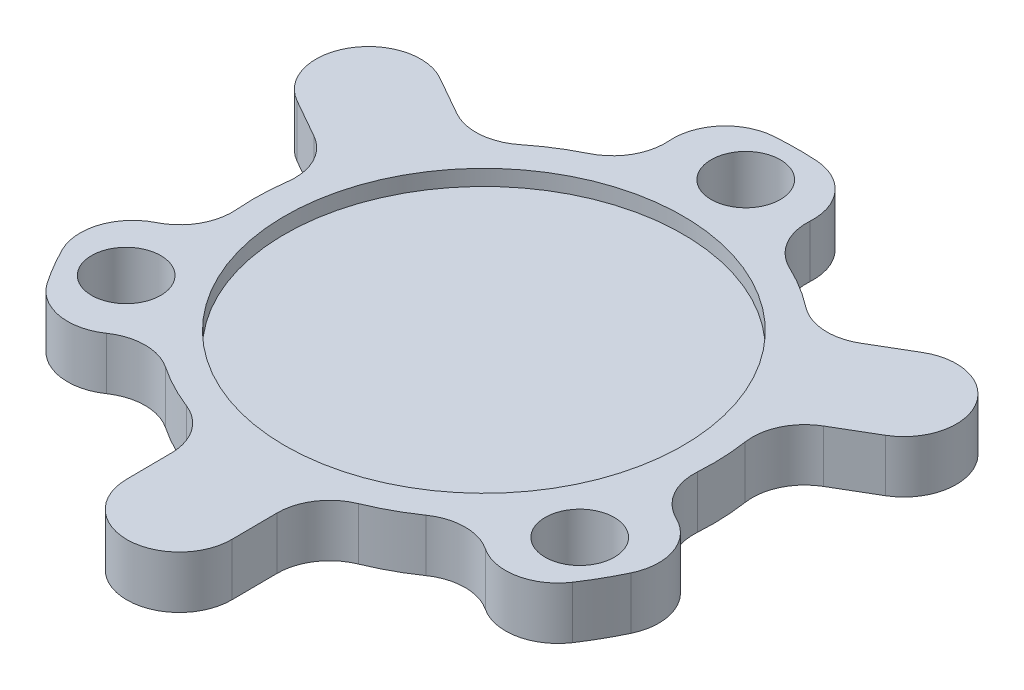
from build123d import *

# Parameters (mm, degrees)
SKETCH1_R           = 19
BOSS_EXTRUDE1_DEPTH = 3.5
SKETCH2_R           = 30
SKETCH2_R_2         = 19
SKETCH2_R_3         = 3.3
BOSS_EXTRUDE2_DEPTH = 5
CUT_EXTRUDE1_DEPTH  = 10
FILLET1_R           = 5
FILLET2_R           = 5
BOSS_EXTRUDE3_DEPTH = 5
FILLET3_R           = 5


with BuildPart() as part:
    # Sketch1 → Boss-Extrude1 (new body)
    with BuildSketch(Plane(origin=(0, 0, 0), x_dir=(1, 0, 0), z_dir=(0, 1, 0))):
        with Locations(Location((0, 0, 0), (0, 0, 270))):
            Circle(SKETCH1_R)
    extrude(amount=BOSS_EXTRUDE1_DEPTH)

    # Sketch2 → Boss-Extrude2 (add)
    with BuildSketch(Plane(origin=(0, 0, 0), x_dir=(1, 0, 0), z_dir=(0, 1, 0))):
        with Locations(Location((0, 0, 0), (0, 0, 270))):
            Circle(SKETCH2_R)
        with Locations(Location((0, 0, 0), (0, 0, 270))):
            Circle(SKETCH2_R_2, mode=Mode.SUBTRACT)
        with Locations(Location((0, 25, 0), (0, 0, 270))):
            Circle(SKETCH2_R_3, mode=Mode.SUBTRACT)
        with Locations(Location((21.650635095, -12.5, 0), (0, 0, 270))):
            Circle(SKETCH2_R_3, mode=Mode.SUBTRACT)
        with Locations(Location((-21.650635095, -12.5, 0), (0, 0, 270))):
            Circle(SKETCH2_R_3, mode=Mode.SUBTRACT)
    extrude(amount=BOSS_EXTRUDE2_DEPTH)

    # Sketch3 → Cut-Extrude1 (cut)
    with BuildSketch(Plane(origin=(0, 5, 0), x_dir=(1, 0, 0), z_dir=(0, 1, 0))):
        with BuildLine():
            ThreePointArc((-21.118635707, -5.827917926), (-19.054090803, 10.812170232), (-5.827917926, 21.118635707))
            Line((-5.827917926, 21.118635707), (-13.837584906, 50.143279023))
            Line((-13.837584906, 50.143279023), (-44.884574983, -12.386388154))
            Line((-44.884574983, -12.386388154), (-21.118635707, -5.827917926))
        make_face()
        with BuildLine():
            Line((11.715360689, 45.064376251), (5.512192878, 21.203233978))
            ThreePointArc((5.512192878, 21.203233978), (18.890659493, 11.095241566), (21.203233978, -5.512192878))
            Line((21.203233978, -5.512192878), (50.344145916, -13.087939456))
            Line((50.344145916, -13.087939456), (11.715360689, 45.064376251))
        make_face()
        with BuildLine():
            Line((33.169214294, -32.677988097), (15.606442829, -15.375316053))
            ThreePointArc((15.606442829, -15.375316053), (0.163431311, -21.907411798), (-15.375316053, -15.606442829))
            Line((-15.375316053, -15.606442829), (-36.50656101, -37.055339567))
            Line((-36.50656101, -37.055339567), (33.169214294, -32.677988097))
        make_face()
    extrude(amount=-CUT_EXTRUDE1_DEPTH, mode=Mode.SUBTRACT)

    # Fillet1
    fillet1_edges = [part.edges().sort_by_distance(p)[0] for p in [
        (15.606442829, 2.5, 15.375316053),
        (-15.375316053, 2.5, 15.606442829),
        (5.512192878, 2.5, -21.203233978),
        (21.203233978, 2.5, 5.512192878),
        (-5.827917926, 2.5, -21.118635707),
        (-21.118635707, 2.5, 5.827917926),
    ]]
    fillet(fillet1_edges, radius=FILLET1_R)

    # Fillet2
    fillet2_edges = [part.edges().sort_by_distance(p)[0] for p in [
        (-28.919045667, 2.5, 7.980526156),
        (-21.054365122, 2.5, 21.37086122),
        (21.37086122, 2.5, 21.054365122),
        (29.034891279, 2.5, 7.548184446),
        (7.548184446, 2.5, -29.034891279),
        (-7.980526156, 2.5, -28.919045667),
    ]]
    fillet(fillet2_edges, radius=FILLET2_R)

    # Sketch4 → Boss-Extrude3 (add)
    with BuildSketch(Plane(origin=(0, 5, 0), x_dir=(1, 0, 0), z_dir=(0, 1, 0))):
        with BuildLine():
            Line((-23.015349461, 18.808873485), (-18.666693218, 16.341245296))
            ThreePointArc((-18.666693218, 16.341245296), (-16.785665163, 9.524960864), (-23.601949596, 7.64393281))
            Line((-23.601949596, 7.64393281), (-27.950605839, 10.111560999))
            ThreePointArc((-27.950605839, 10.111560999), (-29.831633893, 16.927845431), (-23.015349461, 18.808873485))
        make_face()
        with BuildLine():
            Line((22.732171617, 19.150154208), (18.420814796, 16.617921524))
            ThreePointArc((18.420814796, 16.617921524), (16.64169066, 9.774332019), (23.485280165, 7.995207883))
            Line((23.485280165, 7.995207883), (27.796636985, 10.527440567))
            ThreePointArc((27.796636985, 10.527440567), (29.575761121, 17.371030072), (22.732171617, 19.150154208))
        make_face()
        with BuildLine():
            Line((5.218434222, -29.261715207), (5.181134799, -24.261854334))
            ThreePointArc((5.181134799, -24.261854334), (0.143974503, -19.299292883), (-4.818586947, -24.336453179))
            Line((-4.818586947, -24.336453179), (-4.781287525, -29.336314053))
            ThreePointArc((-4.781287525, -29.336314053), (0.255872772, -34.298875503), (5.218434222, -29.261715207))
        make_face()
    extrude(amount=-BOSS_EXTRUDE3_DEPTH)

    # Fillet3
    fillet3_edges = [part.edges().sort_by_distance(p)[0] for p in [
        (16.446740852, 2.5, -14.472944303),
        (20.650460301, 2.5, -7.315729002),
        (4.310567008, 2.5, 21.479767539),
        (-3.989622988, 2.5, 21.541687722),
        (-20.757307861, 2.5, -7.006823236),
        (-16.660837313, 2.5, -14.22595872),
    ]]
    fillet(fillet3_edges, radius=FILLET3_R)


solid = part.part
